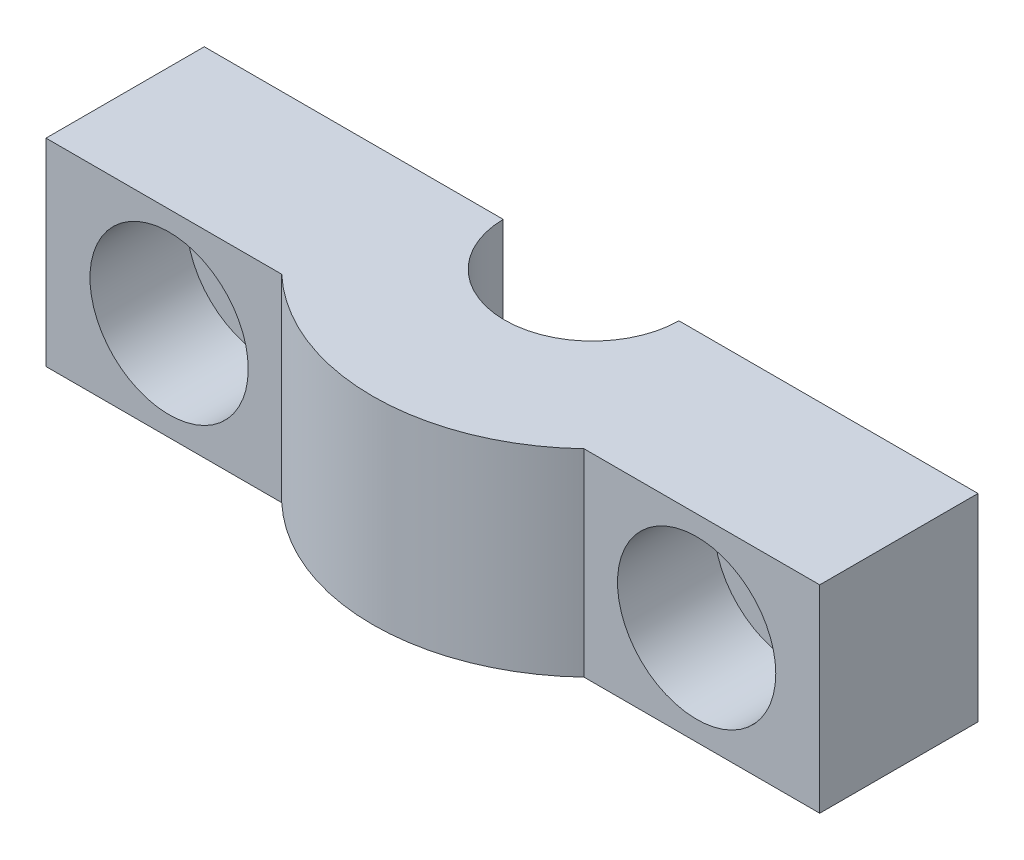
from build123d import *

# Parameters (mm, degrees)
BOSS_EXTRUDE2_DEPTH = 11.25
SKETCH3_R           = 1.75
CUT_EXTRUDE1_DEPTH  = 15
SKETCH4_R           = 4.5
CUT_EXTRUDE2_DEPTH  = 5.5


with BuildPart() as part:
    # Sketch2 → Boss-Extrude2 (new body)
    with BuildSketch(Plane(origin=(0, 0, 0), x_dir=(1, 0, 0), z_dir=(0, 1, 0))):
        with BuildLine():
            Line((4.999419692, -0.076175713), (21.999868119, -0.076175713))
            Line((21.999868119, -0.076175713), (21.999868119, -9.076175713))
            Line((21.999868119, -9.076175713), (8.594942375, -9.076175713))
            ThreePointArc((8.594942375, -9.076175713), (0, -12.5), (-8.594942375, -9.076175713))
            Line((-8.594942375, -9.076175713), (-21.999868119, -9.076175713))
            Line((-21.999868119, -9.076175713), (-21.999868119, -0.076175713))
            Line((-21.999868119, -0.076175713), (-4.999419692, -0.076175713))
            ThreePointArc((-4.999419692, -0.076175713), (0, -5), (4.999419692, -0.076175713))
        make_face()
    extrude(amount=BOSS_EXTRUDE2_DEPTH)

    # Sketch3 → Cut-Extrude1 (cut)
    with BuildSketch(Plane.XY.offset(9.076175713)):
        with Locations((15, 5.625)):
            Circle(SKETCH3_R)
        with Locations((-15, 5.625)):
            Circle(SKETCH3_R)
    extrude(amount=-CUT_EXTRUDE1_DEPTH, mode=Mode.SUBTRACT)

    # Sketch4 → Cut-Extrude2 (cut)
    with BuildSketch(Plane.XY.offset(9.076175713)):
        with Locations((15, 5.625)):
            Circle(SKETCH4_R)
        with Locations((-15, 5.625)):
            Circle(SKETCH4_R)
    extrude(amount=-CUT_EXTRUDE2_DEPTH, mode=Mode.SUBTRACT)


solid = part.part
